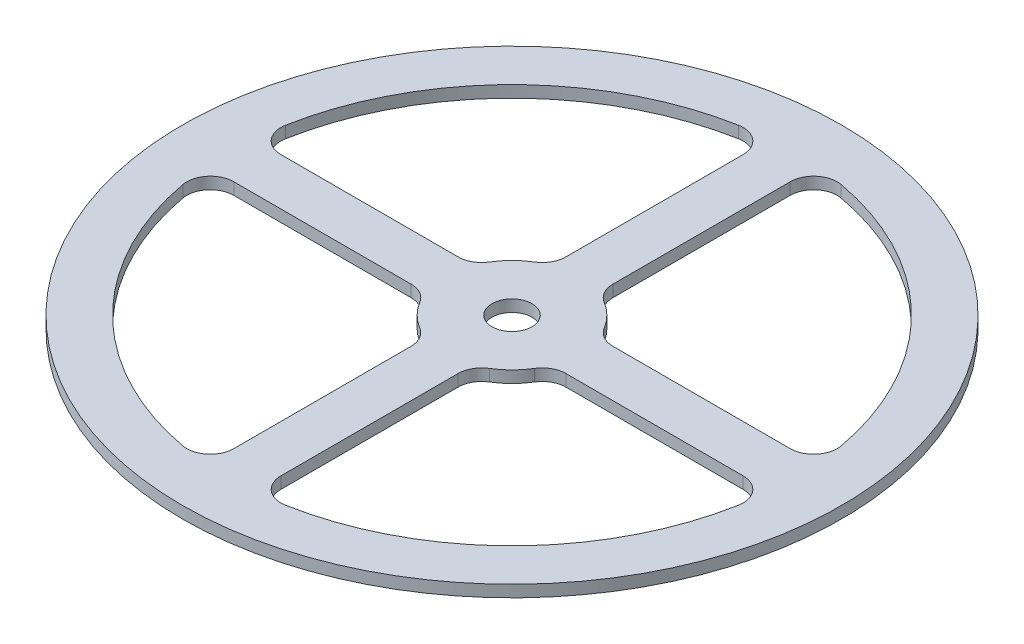
from build123d import *

# Parameters (mm, degrees)
SKETCH_1_R      = 140
SKETCH_1_R_2    = 8.5
EXTRUDE_1_DEPTH = 5


with BuildPart() as part:
    # ｽｹｯﾁ1 → ﾎﾞｽ - 押し出し1 (new body)
    with BuildSketch(Plane(origin=(0, 0, 0), x_dir=(1, 0, 0), z_dir=(0, 1, 0))):
        with Locations(Location((0, 0, 0), (0, 0, 270))):
            Circle(SKETCH_1_R)
        with Locations(Location((0, 0, 0), (0, 0, 270))):
            Circle(SKETCH_1_R_2, mode=Mode.SUBTRACT)
        with BuildLine():
            Line((-108.166538264, 10), (-32.897568299, 10))
            ThreePointArc((-32.897568299, 10), (-27.995938568, 11.283691953), (-24.352745364, 14.805194805))
            ThreePointArc((-24.352745364, 14.805194805), (-20.152543264, 20.152543264), (-14.805194805, 24.352745364))
            ThreePointArc((-14.805194805, 24.352745364), (-11.283691953, 27.995938568), (-10, 32.897568299))
            Line((-10, 32.897568299), (-10, 108.166538264))
            ThreePointArc((-10, 108.166538264), (-13.603978509, 115.853599412), (-21.818181818, 117.999859924))
            ThreePointArc((-21.818181818, 117.999859924), (-84.852813742, 84.852813742), (-117.999859924, 21.818181818))
            ThreePointArc((-117.999859924, 21.818181818), (-115.853599412, 13.603978509), (-108.166538264, 10))
        make_face(mode=Mode.SUBTRACT)
        with BuildLine():
            Line((10, 108.166538264), (10, 32.897568299))
            ThreePointArc((10, 32.897568299), (11.283691953, 27.995938568), (14.805194805, 24.352745364))
            ThreePointArc((14.805194805, 24.352745364), (20.152543264, 20.152543264), (24.352745364, 14.805194805))
            ThreePointArc((24.352745364, 14.805194805), (27.995938568, 11.283691953), (32.897568299, 10))
            Line((32.897568299, 10), (108.166538264, 10))
            ThreePointArc((108.166538264, 10), (115.853599412, 13.603978509), (117.999859924, 21.818181818))
            ThreePointArc((117.999859924, 21.818181818), (84.852813742, 84.852813742), (21.818181818, 117.999859924))
            ThreePointArc((21.818181818, 117.999859924), (13.603978509, 115.853599412), (10, 108.166538264))
        make_face(mode=Mode.SUBTRACT)
        with BuildLine():
            Line((108.166538264, -10), (32.897568299, -10))
            ThreePointArc((32.897568299, -10), (27.995938568, -11.283691953), (24.352745364, -14.805194805))
            ThreePointArc((24.352745364, -14.805194805), (20.152543264, -20.152543264), (14.805194805, -24.352745364))
            ThreePointArc((14.805194805, -24.352745364), (11.283691953, -27.995938568), (10, -32.897568299))
            Line((10, -32.897568299), (10, -108.166538264))
            ThreePointArc((10, -108.166538264), (13.603978509, -115.853599412), (21.818181818, -117.999859924))
            ThreePointArc((21.818181818, -117.999859924), (84.852813742, -84.852813742), (117.999859924, -21.818181818))
            ThreePointArc((117.999859924, -21.818181818), (115.853599412, -13.603978509), (108.166538264, -10))
        make_face(mode=Mode.SUBTRACT)
        with BuildLine():
            Line((-10, -108.166538264), (-10, -32.897568299))
            ThreePointArc((-10, -32.897568299), (-11.283691953, -27.995938568), (-14.805194805, -24.352745364))
            ThreePointArc((-14.805194805, -24.352745364), (-20.152543264, -20.152543264), (-24.352745364, -14.805194805))
            ThreePointArc((-24.352745364, -14.805194805), (-27.995938568, -11.283691953), (-32.897568299, -10))
            Line((-32.897568299, -10), (-108.166538264, -10))
            ThreePointArc((-108.166538264, -10), (-115.853599412, -13.603978509), (-117.999859924, -21.818181818))
            ThreePointArc((-117.999859924, -21.818181818), (-84.852813742, -84.852813742), (-21.818181818, -117.999859924))
            ThreePointArc((-21.818181818, -117.999859924), (-13.603978509, -115.853599412), (-10, -108.166538264))
        make_face(mode=Mode.SUBTRACT)
    extrude(amount=EXTRUDE_1_DEPTH)


solid = part.part
